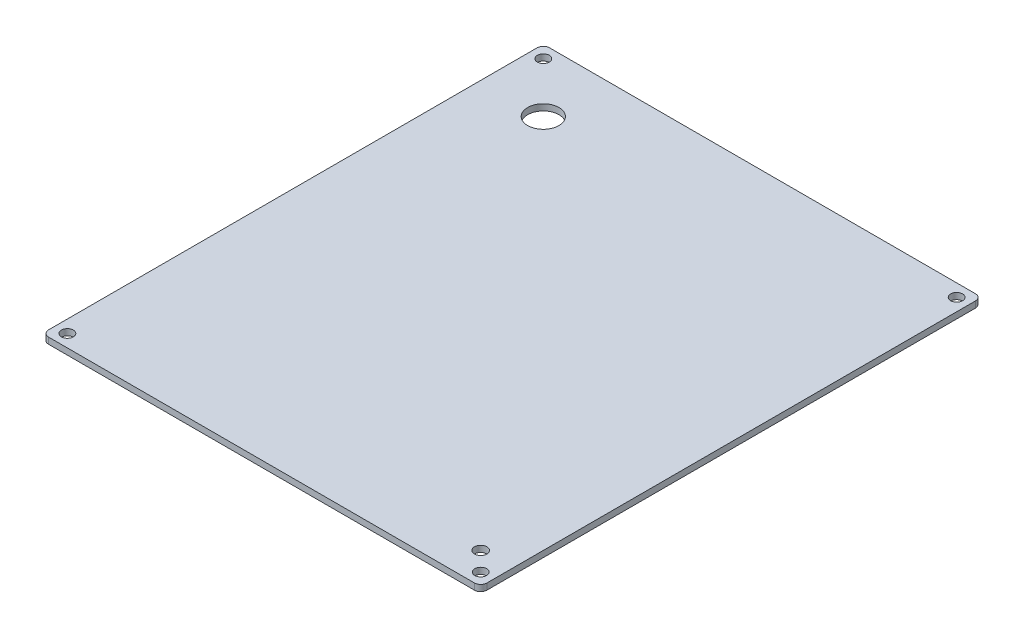
from build123d import *

# Parameters (mm, degrees)
SKETCH1_W           = 140
SKETCH1_H           = 160
BOSS_EXTRUDE1_DEPTH = 2
SKETCH2_R           = 1.9
SKETCH2_R_2         = 2
SKETCH2_R_3         = 5
CUT_EXTRUDE1_DEPTH  = 10
FILLET1_R           = 2


with BuildPart() as part:
    # Sketch1 → Boss-Extrude1 (new body)
    with BuildSketch(Plane(origin=(0, 0, 0), x_dir=(1, 0, 0), z_dir=(0, 1, 0))):
        with Locations((70, 80)):
            Rectangle(SKETCH1_W, SKETCH1_H)
    extrude(amount=BOSS_EXTRUDE1_DEPTH)

    # Sketch2 → Cut-Extrude1 (cut)
    with BuildSketch(Plane(origin=(0, 2, 0), x_dir=(1, 0, 0), z_dir=(0, 1, 0))):
        with Locations(Location((4, 156, 0), (0, 0, 270))):
            Circle(SKETCH2_R)
        with Locations(Location((136, 156, 0), (0, 0, 90))):
            Circle(SKETCH2_R)
        with Locations(Location((136, 4, 0), (0, 0, 270))):
            Circle(SKETCH2_R)
        with Locations(Location((4, 4, 0), (0, 0, 90))):
            Circle(SKETCH2_R)
        with Locations(Location((130, 10, 0), (0, 0, 270))):
            Circle(SKETCH2_R_2)
        with Locations(Location((20, 140, 0), (0, 0, 270))):
            Circle(SKETCH2_R_3)
    extrude(amount=-CUT_EXTRUDE1_DEPTH, mode=Mode.SUBTRACT)

    # Fillet1
    fillet1_edges = [part.edges().sort_by_distance(p)[0] for p in [
        (0, 1, -160),
        (140, 1, -160),
        (140, 1, 0),
        (0, 1, 0),
    ]]
    fillet(fillet1_edges, radius=FILLET1_R)


solid = part.part
